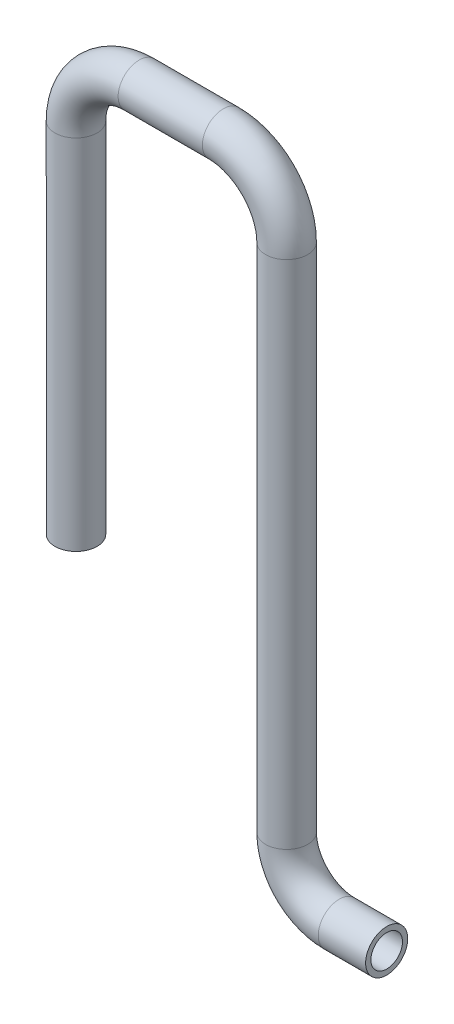
from build123d import *

# Parameters (mm, degrees)
TUBE_PROFILE_R   = 4
TUBE_PROFILE_R_2 = 3


with BuildPart() as part:
    # Tube: sweep along a curve in space
    with BuildLine() as tube_path:
        Line((59, 21, 35), (50, 21, 35))
        ThreePointArc((40, 31, 35), (42.928932188, 23.928932188, 35), (50, 21, 35))
        Line((40, 31, 35), (40, 128, 35))
        ThreePointArc((28, 140, 35), (36.485281374, 136.485281374, 35), (40, 128, 35))
        Line((28, 140, 35), (12, 140, 35))
        ThreePointArc((0, 128, 35), (3.514718626, 136.485281374, 35), (12, 140, 35))
        Line((0, 128, 35), (0, 60, 35))
    # Tube profile (on start of the path) → Tube (sweep)
    with BuildSketch(Plane(origin=(59, 21, 35), x_dir=(0, 0, -1), z_dir=(-1, 0, 0))):
        Circle(TUBE_PROFILE_R)
        Circle(TUBE_PROFILE_R_2, mode=Mode.SUBTRACT)
    sweep(path=tube_path.line)


solid = part.part
